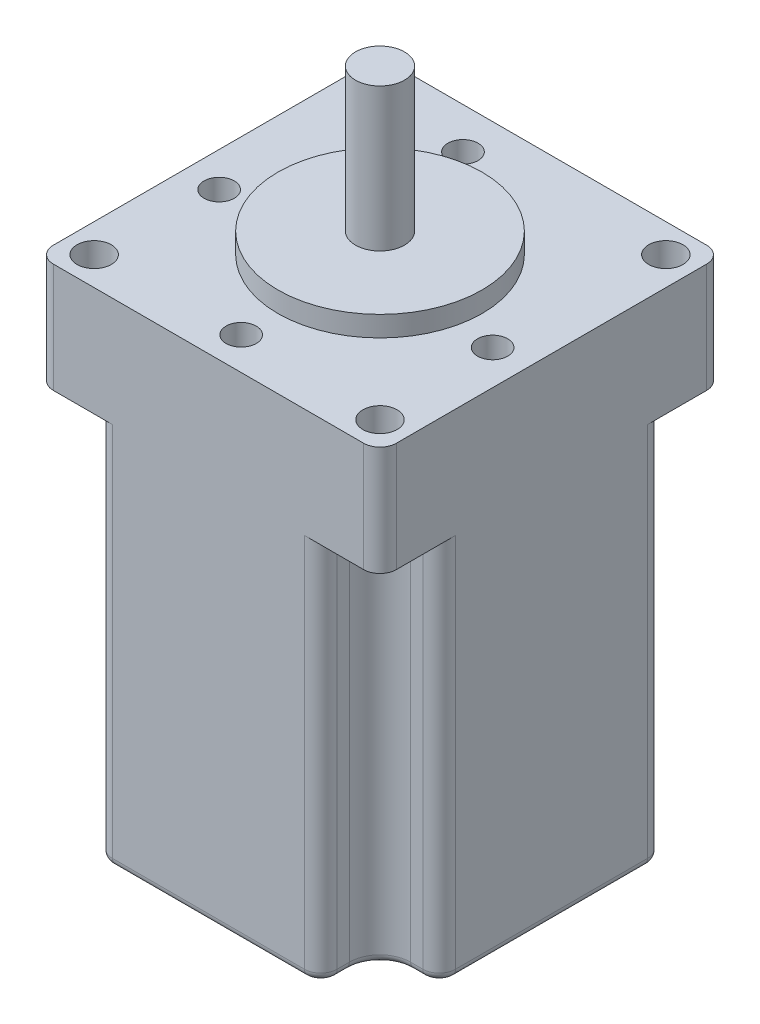
from build123d import *

# Parameters (mm, degrees)
SKETCH1_W                      = 42
SKETCH1_H                      = 42
BOSS_EXTRUDE1_DEPTH            = 60.4
SKETCH2_R                      = 12.5
BOSS_EXTRUDE2_DEPTH            = 2.5
SKETCH4_R                      = 3
BOSS_EXTRUDE3_DEPTH            = 20
CUT_EXTRUDE1_DEPTH             = 47
F_4_2_4_2_DIAMETER_HOLE1_D     = 4.2
CIRPATTERN1_COUNT              = 4
F_3_7_3_7_DIAMETER_HOLE1_D     = 3.7
F_3_7_3_7_DIAMETER_HOLE1_DEPTH = 6
F_3_7_3_7_DIAMETER_HOLE1_TIP   = 1.111592145
FILLET1_R                      = 2
FILLET2_R                      = 1


with BuildPart() as part:
    # Sketch1 → Boss-Extrude1 (new body)
    with BuildSketch(Plane(origin=(0, 0, 0), x_dir=(1, 0, 0), z_dir=(0, 1, 0))):
        Rectangle(SKETCH1_W, SKETCH1_H)
    extrude(amount=-BOSS_EXTRUDE1_DEPTH)

    # Sketch2 → Boss-Extrude2 (add)
    with BuildSketch(Plane(origin=(0, 0, 0), x_dir=(1, 0, 0), z_dir=(0, 1, 0))):
        with Locations(Location((0, 0, 0), (0, 0, 90))):
            Circle(SKETCH2_R)
    extrude(amount=BOSS_EXTRUDE2_DEPTH)

    # Sketch4 → Boss-Extrude3 (add)
    with BuildSketch(Plane(origin=(0, 0, 0), x_dir=(1, 0, 0), z_dir=(0, 1, 0))):
        with Locations(Location((0, 0, 0), (0, 0, 270))):
            Circle(SKETCH4_R)
    extrude(amount=BOSS_EXTRUDE3_DEPTH)

    # Sketch5 → Cut-Extrude1 (cut)
    with BuildSketch(Plane.XZ.offset(60.4)):
        with BuildLine():
            Line((21, 21), (21, 13.75))
            Line((21, 13.75), (17.5, 13.75))
            ThreePointArc((17.5, 13.75), (14.848349571, 14.848349571), (13.75, 17.5))
            Line((13.75, 17.5), (13.75, 21))
            Line((13.75, 21), (21, 21))
        make_face()
    cut_extrude1 = extrude(amount=-CUT_EXTRUDE1_DEPTH, mode=Mode.SUBTRACT)

    # Ø4.2 (4.2) Diameter Hole1 (through all)
    with Locations(Plane(origin=(0, 0, 0), x_dir=(1, 0, 0), z_dir=(0, 1, 0))):
        with Locations((17.5, -17.5)):
            f_4_2_4_2_diameter_hole1 = Hole(F_4_2_4_2_DIAMETER_HOLE1_D / 2)

    # CirPattern1: Cut-Extrude1, Ø4.2 (4.2) Diameter Hole1 ×4 about axis
    cirpattern1_axis = Axis((0, 0, 0), (0, 1, 0))
    add([cut_extrude1.rotate(cirpattern1_axis, i * 360 / CIRPATTERN1_COUNT) for i in range(1, CIRPATTERN1_COUNT)], mode=Mode.SUBTRACT)
    add([f_4_2_4_2_diameter_hole1.rotate(cirpattern1_axis, i * 360 / CIRPATTERN1_COUNT) for i in range(1, CIRPATTERN1_COUNT)], mode=Mode.SUBTRACT)

    # Ø3.7 (3.7) Diameter Hole1
    with Locations(Plane(origin=(0, 0, 0), x_dir=(1, 0, 0), z_dir=(0, 1, 0))):
        with Locations((-5.814342437, 15.974774553), (-16.741731801, -2.95201902), (0, -17), (16.741731801, -2.95201902)):
            Hole(F_3_7_3_7_DIAMETER_HOLE1_D / 2, depth=F_3_7_3_7_DIAMETER_HOLE1_DEPTH)
            with Locations((0, 0, -(F_3_7_3_7_DIAMETER_HOLE1_DEPTH + F_3_7_3_7_DIAMETER_HOLE1_TIP / 2))):  # 118° drill point
                Cone(0, F_3_7_3_7_DIAMETER_HOLE1_D / 2, F_3_7_3_7_DIAMETER_HOLE1_TIP, mode=Mode.SUBTRACT)

    # Fillet1
    fillet1_edges = [part.edges().sort_by_distance(p)[0] for p in [
        (21, -6.7, 21),
        (13.75, -36.9, 21),
        (21, -36.9, 13.75),
        (-21, -6.7, 21),
        (-21, -36.9, 13.75),
        (-13.75, -36.9, 21),
        (21, -6.7, -21),
        (-21, -6.7, -21),
        (-13.75, -36.9, -21),
        (-21, -36.9, -13.75),
        (21, -36.9, -13.75),
        (13.75, -36.9, -21),
    ]]
    fillet(fillet1_edges, radius=FILLET1_R)

    # Fillet2
    fillet2_edges = [part.edges().sort_by_distance(p)[0] for p in [
        (13.75, -60.4, 18.25),
        (-13.75, -60.4, -18.25),
        (0, -60.4, -21),
        (18.25, -60.4, -13.75),
        (21, -60.4, 0),
        (0, -60.4, 21),
        (-18.25, -60.4, 13.75),
        (-21, -60.4, 0),
        (-20.414213562, -60.4, -13.164213562),
        (-20.414213562, -60.4, 13.164213562),
        (-13.164213562, -60.4, -20.414213562),
        (13.164213562, -60.4, -20.414213562),
        (20.414213562, -60.4, -13.164213562),
        (20.414213562, -60.4, 13.164213562),
        (-13.164213562, -60.4, 20.414213562),
        (13.164213562, -60.4, 20.414213562),
        (14.848349571, -60.4, 14.848349571),
        (18.25, -60.4, 13.75),
        (-14.848349571, -60.4, 14.848349571),
        (-13.75, -60.4, 18.25),
        (-14.848349571, -60.4, -14.848349571),
        (-18.25, -60.4, -13.75),
        (14.848349571, -60.4, -14.848349571),
        (13.75, -60.4, -18.25),
    ]]
    fillet(fillet2_edges, radius=FILLET2_R)


solid = part.part
